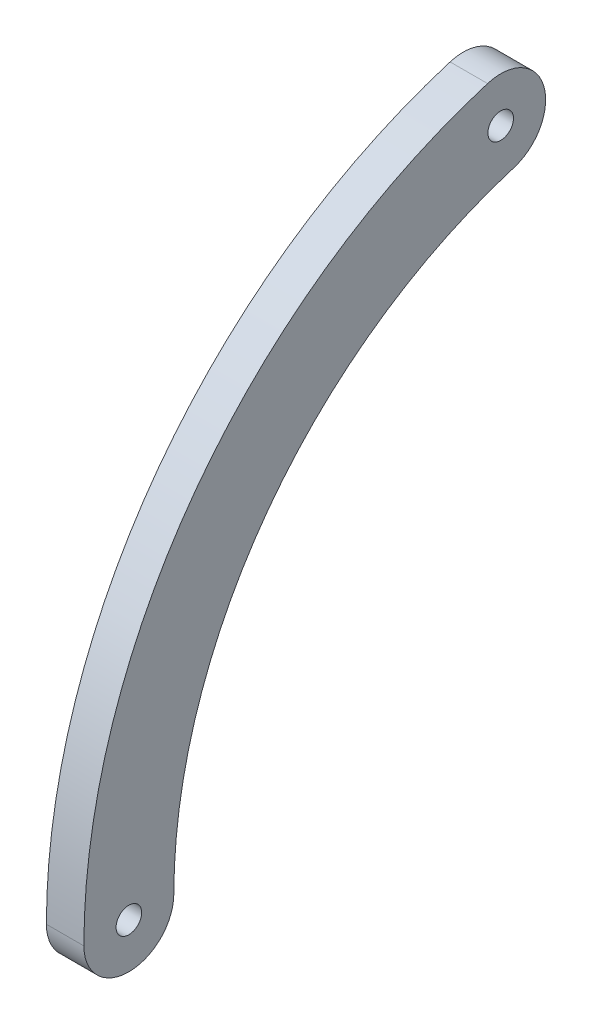
from build123d import *

# Parameters (mm, degrees)
ESQUISSE1_R        = 1.3
BOSS_EXTRU_1_DEPTH = 3.81


with BuildPart() as part:
    # Esquisse1 → Boss.-Extru.1 (new body)
    with BuildSketch(Plane(origin=(0, 0, 0), x_dir=(0, 0, -1), z_dir=(1, 0, 0))):
        with BuildLine():
            ThreePointArc((-48.768, 0), (-39.187496282, 29.028571429), (-14.210176871, 46.651781288))
            ThreePointArc((-14.210176871, 46.651781288), (-11.168776457, 52.357589865), (-16.874585034, 55.398990279))
            ThreePointArc((-16.874585034, 55.398990279), (-46.535151834, 34.471428571), (-57.912, 0))
            ThreePointArc((-57.912, 0), (-53.34, -4.572), (-48.768, 0))
        make_face()
        with Locations(Location((-53.34, 0, 0), (0, 0, 180))):
            Circle(ESQUISSE1_R, mode=Mode.SUBTRACT)
        with Locations(Location((-15.542380952, 51.025385783, 0), (0, 0, 180))):
            Circle(ESQUISSE1_R, mode=Mode.SUBTRACT)
    extrude(amount=BOSS_EXTRU_1_DEPTH)


solid = part.part
